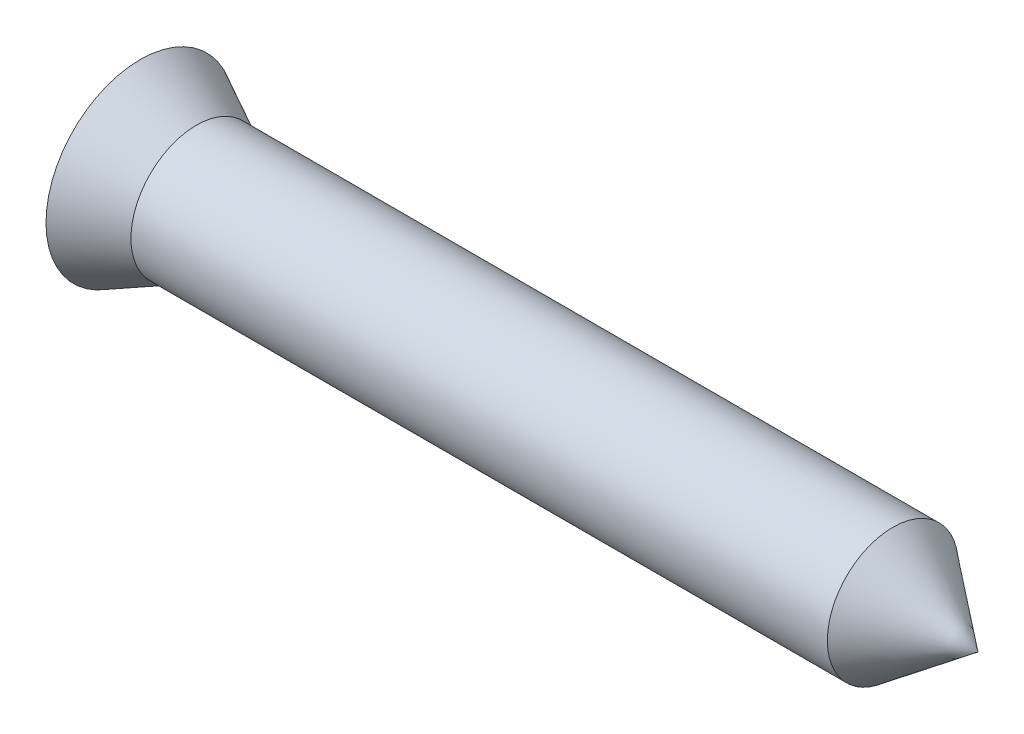
from build123d import *

# Parameters (mm, degrees)
CUT_EXTRUDE2_DEPTH = 0.254


with BuildPart() as part:
    # Sketch1 → Revolve1 (revolve)
    with BuildSketch(Plane.XY):
        Polygon((0, 0), (0, 2.8575), (1.7018, 1.984375), (22.817280365, 1.984375), (25.4, 0), align=None)
    revolve(axis=Axis((25.4, 0, 0), (-1, 0, 0)))

    # Sketch2 → Cut-Extrude2 (cut)
    with BuildSketch(Plane(origin=(0, 0, 0), x_dir=(0, 0, -1), z_dir=(1, 0, 0))):
        with BuildLine():
            Line((1.787373723, 0.564567778), (0.680541301, 0.564567778))
            ThreePointArc((0.680541301, 0.564567778), (0.500936179, 0.638962656), (0.426541301, 0.818567778))
            Line((0.426541301, 0.818567778), (0.426541301, 1.824996112))
            ThreePointArc((0.426541301, 1.824996112), (0.352146424, 2.004601234), (0.172541301, 2.078996112))
            Line((0.172541301, 2.078996112), (-0.147792428, 2.078996112))
            ThreePointArc((-0.147792428, 2.078996112), (-0.327397551, 2.004601234), (-0.401792428, 1.824996112))
            Line((-0.401792428, 1.824996112), (-0.401792428, 0.818567778))
            ThreePointArc((-0.401792428, 0.818567778), (-0.476187306, 0.638962656), (-0.655792428, 0.564567778))
            Line((-0.655792428, 0.564567778), (-1.929964998, 0.564567778))
            ThreePointArc((-1.929964998, 0.564567778), (-2.10957012, 0.490172901), (-2.183964998, 0.310567778))
            Line((-2.183964998, 0.310567778), (-2.183964998, -0.002294215))
            ThreePointArc((-2.183964998, -0.002294215), (-2.10957012, -0.181899337), (-1.929964998, -0.256294215))
            Line((-1.929964998, -0.256294215), (-0.655792428, -0.256294215))
            ThreePointArc((-0.655792428, -0.256294215), (-0.476187306, -0.330689092), (-0.401792428, -0.510294215))
            Line((-0.401792428, -0.510294215), (-0.401792428, -1.900709616))
            ThreePointArc((-0.401792428, -1.900709616), (-0.327397551, -2.080314739), (-0.147792428, -2.154709616))
            Line((-0.147792428, -2.154709616), (0.256211375, -2.154709616))
            ThreePointArc((0.256211375, -2.154709616), (0.435816497, -2.080314739), (0.510211375, -1.900709616))
            Line((0.510211375, -1.900709616), (0.510211375, -0.526132959))
            ThreePointArc((0.510211375, -0.526132959), (0.584606253, -0.346527836), (0.764211375, -0.272132959))
            Line((0.764211375, -0.272132959), (1.787373723, -0.272132959))
            ThreePointArc((1.787373723, -0.272132959), (1.966978846, -0.197738081), (2.041373723, -0.018132959))
            Line((2.041373723, -0.018132959), (2.041373723, 0.310567778))
            ThreePointArc((2.041373723, 0.310567778), (1.966978846, 0.490172901), (1.787373723, 0.564567778))
        make_face()
    extrude(amount=CUT_EXTRUDE2_DEPTH, mode=Mode.SUBTRACT)


solid = part.part
